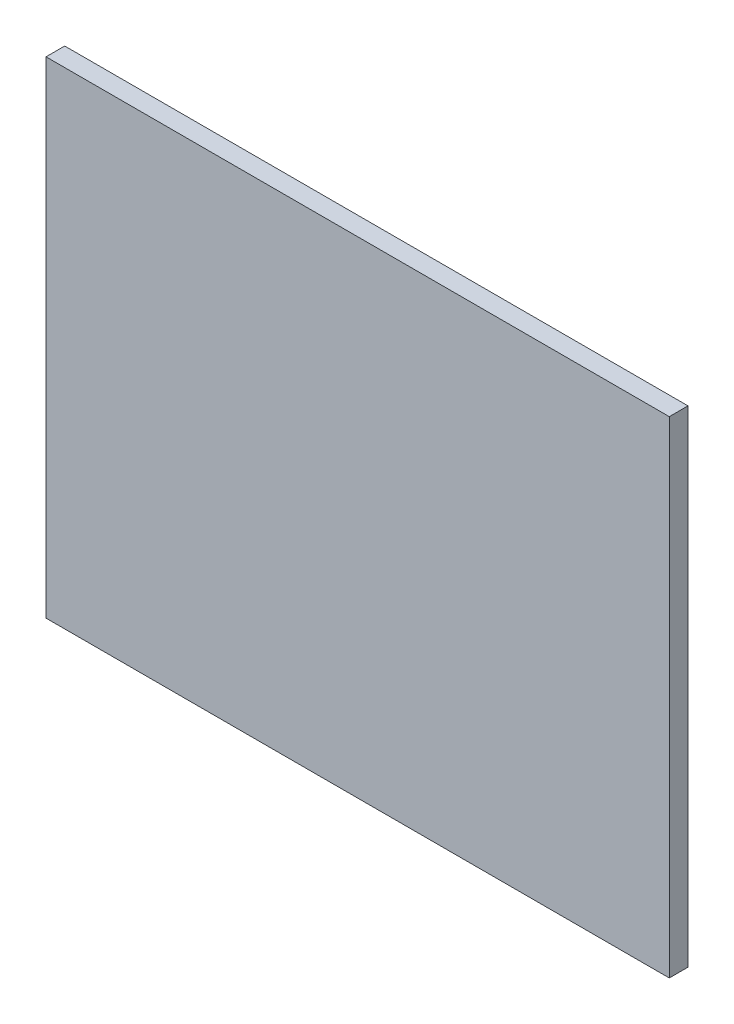
from build123d import *

# Parameters (mm, degrees)
ESBO_O1_W                = 500
ESBO_O1_H                = 390
RESSALTO_EXTRUS_O1_DEPTH = 15


with BuildPart() as part:
    # Esboço1 → Ressalto-extrusão1 (new body)
    with BuildSketch(Plane.XY):
        Rectangle(ESBO_O1_W, ESBO_O1_H)
    extrude(amount=RESSALTO_EXTRUS_O1_DEPTH)


solid = part.part
